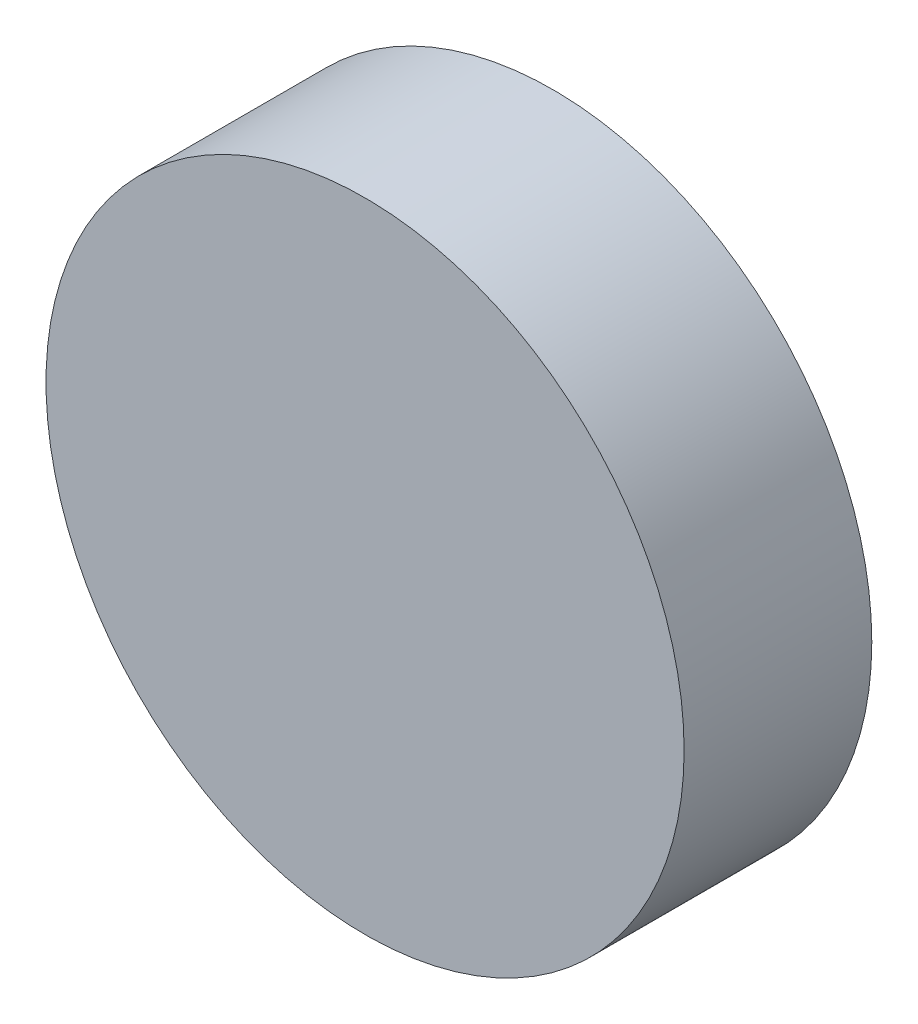
from build123d import *

# Parameters (mm, degrees)
SKETCH1_R           = 8.5
BOSS_EXTRUDE1_DEPTH = 5


with BuildPart() as part:
    # Sketch1 → Boss-Extrude1 (new body)
    with BuildSketch(Plane.XY):
        with Locations((40.506047888, 0.762412286)):
            Circle(SKETCH1_R)
    extrude(amount=BOSS_EXTRUDE1_DEPTH)


solid = part.part
